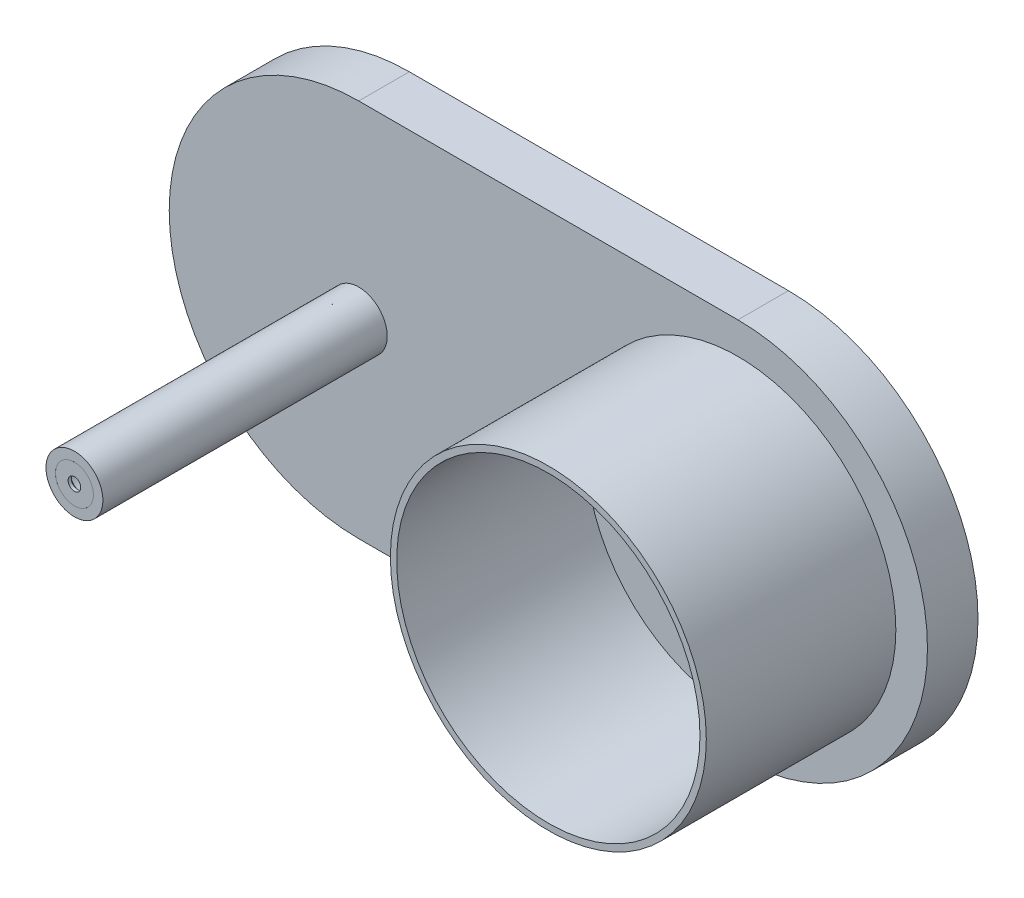
from build123d import *

# Parameters (mm, degrees)
BOSS_EXTRUDE1_DEPTH = 8
SKETCH2_W           = 60
SKETCH2_H           = 3
CUT_EXTRUDE1_DEPTH  = 4
SKETCH3_R           = 4
SKETCH3_R_2         = 3
CUT_EXTRUDE3_DEPTH  = 5.5
BOSS_EXTRUDE3_START = 45
SKETCH4_R           = 4.5
SKETCH4_R_2         = 3
BOSS_EXTRUDE3_DEPTH = 45
SKETCH6_R           = 25
SKETCH6_R_2         = 24
BOSS_EXTRUDE4_DEPTH = 30


with BuildPart() as part:
    # Sketch1 → Boss-Extrude1 (new body)
    with BuildSketch(Plane.XY):
        with BuildLine():
            Line((-30, 30), (30, 30))
            ThreePointArc((30, 30), (60, 0), (30, -30))
            Line((30, -30), (-30, -30))
            ThreePointArc((-30, -30), (-60, 0), (-30, 30))
        make_face()
    extrude(amount=BOSS_EXTRUDE1_DEPTH)

    # Sketch2 → Cut-Extrude1 (cut, symmetric)
    with BuildSketch(Plane(origin=(0, 0, 0), x_dir=(1, 0, 0), z_dir=(0, 1, 0))):
        with Locations((0, -4)):
            Rectangle(SKETCH2_W, SKETCH2_H)
    extrude(amount=CUT_EXTRUDE1_DEPTH, both=True, mode=Mode.SUBTRACT)

    # Sketch3 → Cut-Extrude3 (cut)
    with BuildSketch(Plane.XY.offset(8)):
        with Locations((30, 0)):
            Circle(SKETCH3_R)
        with Locations((-30, 0)):
            Circle(SKETCH3_R_2)
    extrude(amount=-CUT_EXTRUDE3_DEPTH, mode=Mode.SUBTRACT)

    # Sketch4 → Boss-Extrude3 (add)
    with BuildSketch(Plane.XY.offset(8).offset(BOSS_EXTRUDE3_START)):
        with Locations(Location((-30, 0, 0), (0, 0, 180))):
            Circle(SKETCH4_R)
        with Locations((-30, 0)):
            Circle(SKETCH4_R_2, mode=Mode.SUBTRACT)
    extrude(amount=-BOSS_EXTRUDE3_DEPTH)

    # Sketch5 → Revolve1 (revolve)
    with BuildSketch(Plane(origin=(0, 0, 0), x_dir=(1, 0, 0), z_dir=(0, 1, 0)), mode=Mode.PRIVATE) as revolve1_sk:
        Polygon((-33, -52.999308425), (-33, -50.999308425), (-31, -52.499308425), (-31, -52.999308425), align=None)
    revolve(revolve1_sk.sketch.rotate(Axis((-30, 0, 53), (0, 0, 1)), 90), axis=Axis((-30, 0, 53), (0, 0, 1)))

    # Sketch6 → Boss-Extrude4 (add)
    with BuildSketch(Plane.XY.offset(8)):
        with Locations((30, 0)):
            Circle(SKETCH6_R)
        with Locations((30, 0)):
            Circle(SKETCH6_R_2, mode=Mode.SUBTRACT)
    extrude(amount=BOSS_EXTRUDE4_DEPTH)


solid = part.part
